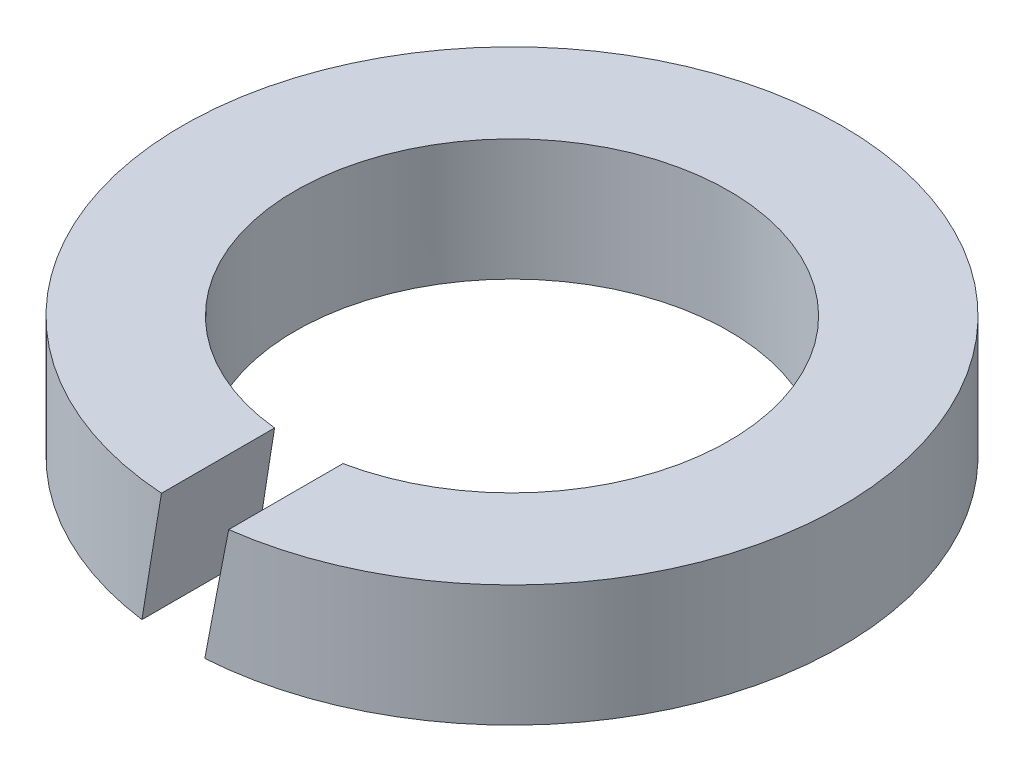
from build123d import *

# Parameters (mm, degrees)
SKETCH_1_R          = 3.8
SKETCH_1_R_2        = 2.5
EXTRUDE_1_DEPTH     = 1.4
CUT_EXTRUDE_1_DEPTH = 6.553377351


with BuildPart() as part:
    # 草图1 → 凸台-拉伸1 (new body)
    with BuildSketch(Plane(origin=(0, 0, 0), x_dir=(1, 0, 0), z_dir=(0, 1, 0))):
        with Locations(Location((0, 0, 0), (0, 0, 270))):
            Circle(SKETCH_1_R)
        with Locations(Location((0, 0, 0), (0, 0, 270))):
            Circle(SKETCH_1_R_2, mode=Mode.SUBTRACT)
    extrude(amount=EXTRUDE_1_DEPTH)

    # 草图2 → 切除-拉伸1 (cut, through all)
    with BuildSketch(Plane.XY):
        Polygon((-0.5, 0), (-0.25, 1.4), (0.5, 1.4), (0.25, 0), align=None)
    extrude(amount=CUT_EXTRUDE_1_DEPTH, mode=Mode.SUBTRACT)


solid = part.part
